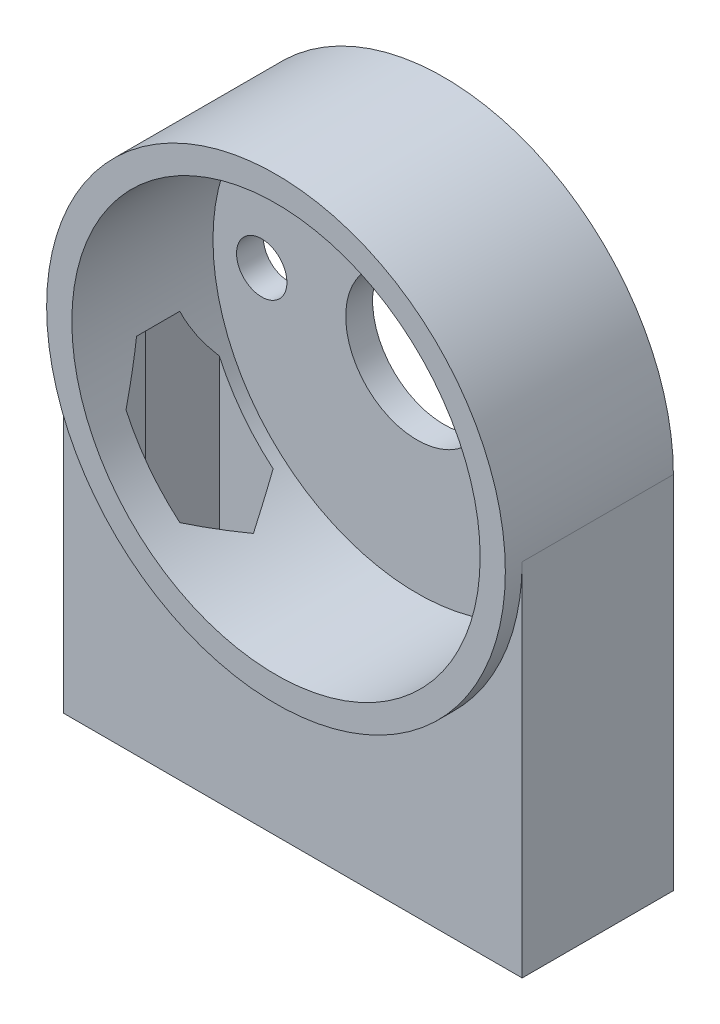
from build123d import *

# Parameters (mm, degrees)
SKETCH1_R           = 13.65
SKETCH1_R_2         = 12.15
BOSS_EXTRUDE1_DEPTH = 10
SKETCH1_4_R         = 12.15
SKETCH1_4_R_2       = 1.5
SKETCH1_4_R_3       = 4.25
BOSS_EXTRUDE2_DEPTH = 1.6
BOSS_EXTRUDE3_DEPTH = 9
SKETCH3_R           = 1.6
CUT_EXTRUDE1_DEPTH  = 18
CUT_EXTRUDE2_START  = 3
CUT_EXTRUDE2_DEPTH  = 16


with BuildPart() as part:
    # Sketch1 → Boss-Extrude1 (new body)
    with BuildSketch(Plane.XY):
        with Locations((0, 21.45)):
            Circle(SKETCH1_R)
        with Locations((0, 21.45)):
            Circle(SKETCH1_R_2, mode=Mode.SUBTRACT)
    extrude(amount=BOSS_EXTRUDE1_DEPTH)

    # Sketch1<4> → Boss-Extrude2 (add)
    with BuildSketch(Plane.XY):
        with Locations((0, 21.45)):
            Circle(SKETCH1_4_R)
        with Locations((-9.25, 21.45)):
            Circle(SKETCH1_4_R_2, mode=Mode.SUBTRACT)
        with Locations((9.25, 21.45)):
            Circle(SKETCH1_4_R_2, mode=Mode.SUBTRACT)
        with Locations((0, 21.45)):
            Circle(SKETCH1_4_R_3, mode=Mode.SUBTRACT)
    extrude(amount=BOSS_EXTRUDE2_DEPTH)

    # Sketch2 → Boss-Extrude3 (add)
    with BuildSketch(Plane.XY):
        with BuildLine():
            Line((-13.65, 21.45), (-13.65, 0))
            Line((-13.65, 0), (13.65, 0))
            Line((13.65, 0), (13.65, 21.45))
            ThreePointArc((13.65, 21.45), (0, 7.8), (-13.65, 21.45))
        make_face()
    extrude(amount=BOSS_EXTRUDE3_DEPTH)

    # Sketch3 → Cut-Extrude1 (cut)
    with BuildSketch(Plane(origin=(0, 0, 0), x_dir=(1, 0, 0), z_dir=(0, 1, 0))):
        with Locations(Location((-9.44, -5.108703369, 0), (0, 0, 90))):
            Circle(SKETCH3_R)
        with Locations(Location((9.44, -5.108703369, 0), (0, 0, 90))):
            Circle(SKETCH3_R)
    extrude(amount=CUT_EXTRUDE1_DEPTH, mode=Mode.SUBTRACT)

    # Sketch4 → Cut-Extrude2 (cut)
    with BuildSketch(Plane(origin=(0, 0, 0), x_dir=(1, 0, 0), z_dir=(0, 1, 0)).offset(CUT_EXTRUDE2_START)):
        Polygon((-7.837853003, -2.333703369), (-11.042146997, -2.333703369), (-12.644293994, -5.108703369), (-11.042146997, -7.883703369), (-7.837853003, -7.883703369), (-6.235706006, -5.108703369), align=None)
        Polygon((11.042146997, -2.333703369), (7.837853003, -2.333703369), (6.235706006, -5.108703369), (7.837853003, -7.883703369), (11.042146997, -7.883703369), (12.644293994, -5.108703369), align=None)
    extrude(amount=CUT_EXTRUDE2_DEPTH, mode=Mode.SUBTRACT)


solid = part.part
